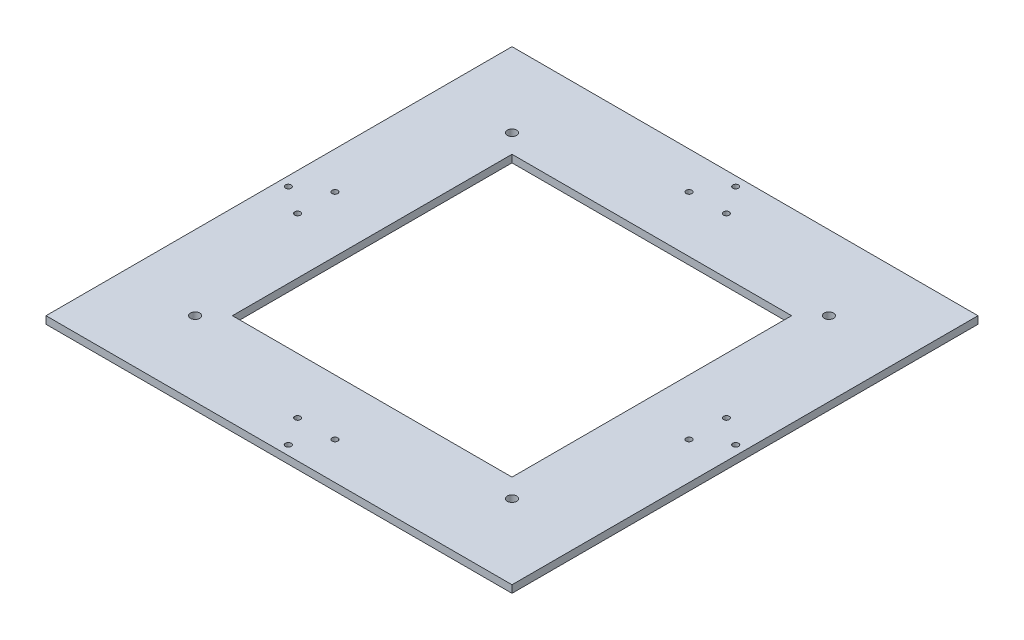
from build123d import *

# Parameters (mm, degrees)
CROQUIS1_W              = 250
CROQUIS1_H              = 250
CROQUIS1_R              = 2.5
SALIENTE_EXTRUIR1_DEPTH = 4
CORTAR_EXTRUIR1_DEPTH   = 4
CROQUIS3_W              = 150
CROQUIS3_H              = 150
CROQUIS3_W_2            = 100
CROQUIS3_H_2            = 100
SALIENTE_EXTRUIR2_DEPTH = 4
CROQUIS4_R              = 1.55
CORTAR_EXTRUIR2_DEPTH   = 10
CROQUIS5_W              = 150
CROQUIS5_H              = 150
CROQUIS5_W_2            = 100
CROQUIS5_H_2            = 100
CORTAR_EXTRUIR3_DEPTH   = 10
CROQUIS6_R              = 1.55
CORTAR_EXTRUIR4_DEPTH   = 10


with BuildPart() as part:
    # Croquis1 → Saliente-Extruir1 (new body)
    with BuildSketch(Plane(origin=(0, 0, 0), x_dir=(1, 0, 0), z_dir=(0, 1, 0))):
        with Locations((125, 125)):
            Rectangle(CROQUIS1_W, CROQUIS1_H)
        with Locations(Location((40, 210, 0), (0, 0, 270))):
            Circle(CROQUIS1_R, mode=Mode.SUBTRACT)
        with Locations(Location((210, 210, 0), (0, 0, 270))):
            Circle(CROQUIS1_R, mode=Mode.SUBTRACT)
        with Locations(Location((210, 40, 0), (0, 0, 270))):
            Circle(CROQUIS1_R, mode=Mode.SUBTRACT)
        with Locations(Location((40, 40, 0), (0, 0, 270))):
            Circle(CROQUIS1_R, mode=Mode.SUBTRACT)
    extrude(amount=SALIENTE_EXTRUIR1_DEPTH)

    # Croquis2 → Cortar-Extruir1 (cut)
    with BuildSketch(Plane(origin=(0, 4, 0), x_dir=(1, 0, 0), z_dir=(0, 1, 0))):
        Polygon((50, 50), (200, 50), (200, 200), (50, 200), (50, 150.09044268), align=None)
    extrude(amount=-CORTAR_EXTRUIR1_DEPTH, mode=Mode.SUBTRACT)

    # Croquis3 → Saliente-Extruir2 (add)
    with BuildSketch(Plane(origin=(0, 4, 0), x_dir=(1, 0, 0), z_dir=(0, 1, 0))):
        with Locations((125, 125)):
            Rectangle(CROQUIS3_W, CROQUIS3_H)
        with Locations((125, 125)):
            Rectangle(CROQUIS3_W_2, CROQUIS3_H_2, mode=Mode.SUBTRACT)
    extrude(amount=-SALIENTE_EXTRUIR2_DEPTH)

    # Croquis4 → Cortar-Extruir2 (cut)
    with BuildSketch(Plane(origin=(0, 4, 0), x_dir=(1, 0, 0), z_dir=(0, 1, 0))):
        with Locations(Location((115, 20, 0), (0, 0, 270))):
            Circle(CROQUIS4_R)
        with Locations(Location((135, 20, 0), (0, 0, 270))):
            Circle(CROQUIS4_R)
        with Locations(Location((125, 5, 0), (0, 0, 270))):
            Circle(CROQUIS4_R)
    extrude(amount=-CORTAR_EXTRUIR2_DEPTH, mode=Mode.SUBTRACT)

    # Croquis5 → Cortar-Extruir3 (cut)
    with BuildSketch(Plane(origin=(0, 4, 0), x_dir=(1, 0, 0), z_dir=(0, 1, 0))):
        with Locations((125, 125)):
            Rectangle(CROQUIS5_W, CROQUIS5_H)
        with Locations((125, 125)):
            Rectangle(CROQUIS5_W_2, CROQUIS5_H_2, mode=Mode.SUBTRACT)
    extrude(amount=-CORTAR_EXTRUIR3_DEPTH, mode=Mode.SUBTRACT)

    # Croquis6 → Cortar-Extruir4 (cut)
    with BuildSketch(Plane(origin=(0, 4, 0), x_dir=(1, 0, 0), z_dir=(0, 1, 0))):
        with Locations(Location((125, 5, 0), (0, 0, 270))):
            Circle(CROQUIS6_R)
        with Locations(Location((115, 20, 0), (0, 0, 270))):
            Circle(CROQUIS6_R)
        with Locations(Location((135, 20, 0), (0, 0, 270))):
            Circle(CROQUIS6_R)
        with Locations(Location((20, 115, 0), (0, 0, 270))):
            Circle(CROQUIS6_R)
        with Locations(Location((20, 135, 0), (0, 0, 270))):
            Circle(CROQUIS6_R)
        with Locations(Location((5, 125, 0), (0, 0, 270))):
            Circle(CROQUIS6_R)
        with Locations(Location((115, 230, 0), (0, 0, 270))):
            Circle(CROQUIS6_R)
        with Locations(Location((135, 230, 0), (0, 0, 270))):
            Circle(CROQUIS6_R)
        with Locations(Location((125, 245, 0), (0, 0, 270))):
            Circle(CROQUIS6_R)
        with Locations(Location((230, 135, 0), (0, 0, 270))):
            Circle(CROQUIS6_R)
        with Locations(Location((230, 115, 0), (0, 0, 270))):
            Circle(CROQUIS6_R)
        with Locations(Location((245, 125, 0), (0, 0, 270))):
            Circle(CROQUIS6_R)
    extrude(amount=-CORTAR_EXTRUIR4_DEPTH, mode=Mode.SUBTRACT)


solid = part.part
